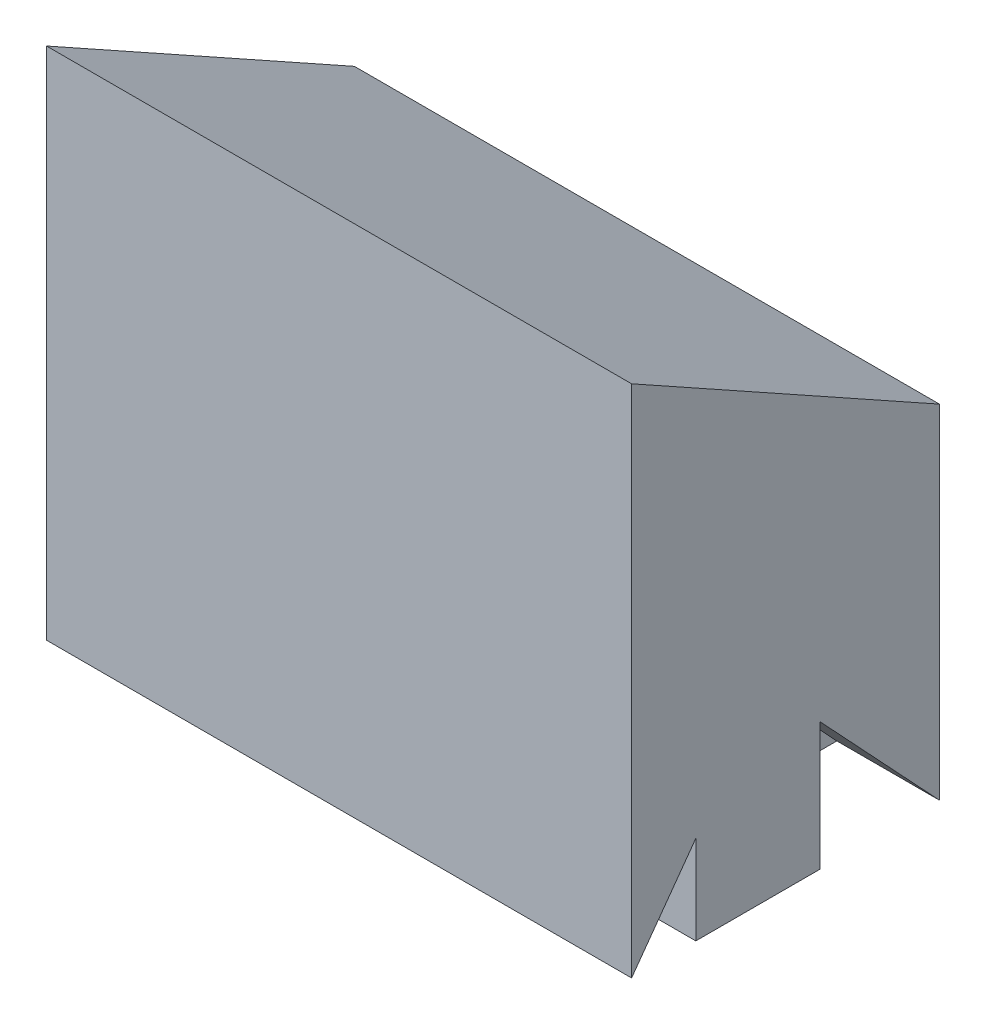
from build123d import *

# Parameters (mm, degrees)
SKETCH_1_W          = 57.008230548
SKETCH_1_H          = 50.142083818
EXTRUDE_2_DEPTH     = 30
CUT_EXTRUDE_1_DEPTH = 82.634348897
CUT_EXTRUDE_2_DEPTH = 10
CUT_EXTRUDE_3_DEPTH = 28
CUT_EXTRUDE_4_DEPTH = 82.634348897


with BuildPart() as part:
    # 草圖1 → 填料-伸長2 (new body)
    with BuildSketch(Plane.XY):
        with Locations((42.353664605, 25.071041909)):
            Rectangle(SKETCH_1_W, SKETCH_1_H)
    extrude(amount=EXTRUDE_2_DEPTH)

    # 草圖2 → 除料-伸長1 (cut, through all)
    with BuildSketch(Plane.ZY.offset(-13.849549331)):
        Polygon((30, 50.142083818), (0, 33.426531832), (0, 50.142083818), align=None)
    extrude(amount=-CUT_EXTRUDE_1_DEPTH, mode=Mode.SUBTRACT)

    # 草圖3 → 除料-伸長2 (cut)
    with BuildSketch(Plane(origin=(70.857779879, 0, 0), x_dir=(0, 0, -1), z_dir=(1, 0, 0))):
        Polygon((-11.643819947, 12.450406502), (-11.643819947, 0), (0, 0), align=None)
    extrude(amount=-CUT_EXTRUDE_2_DEPTH, mode=Mode.SUBTRACT)

    # 草圖6 → 除料-伸長3 (cut)
    with BuildSketch(Plane.ZY.offset(-13.849549331)):
        Polygon((30, 0), (20.225842112, 16.602142494), (20.225842112, 0), align=None)
    extrude(amount=-CUT_EXTRUDE_3_DEPTH, mode=Mode.SUBTRACT)

    # 草圖7 → 除料-伸長4 (cut, through all)
    with BuildSketch(Plane(origin=(70.857779879, 0, 0), x_dir=(0, 0, -1), z_dir=(1, 0, 0))):
        Polygon((-30, 0), (-23.742805889, 8.65630368), (-23.742805889, 0), align=None)
    extrude(amount=-CUT_EXTRUDE_4_DEPTH, mode=Mode.SUBTRACT)


solid = part.part
